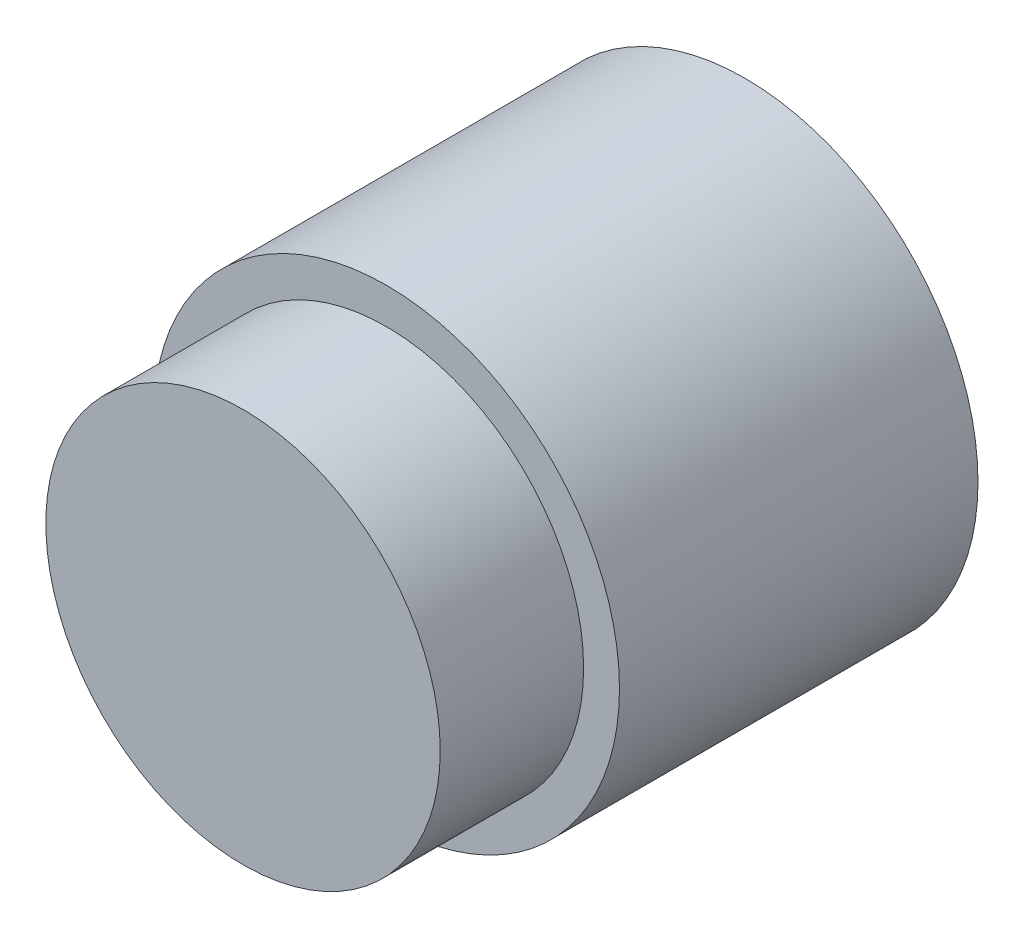
from build123d import *

# Parameters (mm, degrees)
ESQUISSE2_R        = 0.65
BOSS_EXTRU_1_DEPTH = 1
ESQUISSE3_R        = 0.55
BOSS_EXTRU_3_DEPTH = 0.4


with BuildPart() as part:
    # Esquisse2 → Boss.-Extru.1 (new body)
    with BuildSketch(Plane.XY):
        Circle(ESQUISSE2_R)
    extrude(amount=BOSS_EXTRU_1_DEPTH)

    # Esquisse3 → Boss.-Extru.3 (add)
    with BuildSketch(Plane.XY.offset(1)):
        Circle(ESQUISSE3_R)
    extrude(amount=BOSS_EXTRU_3_DEPTH)


solid = part.part
